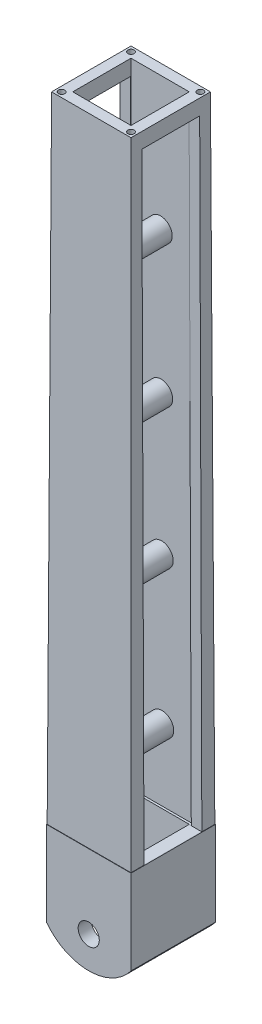
from build123d import *

# Parameters (mm, degrees)
SKETCH1_W               = 80
SKETCH1_H               = 80
BOSS_EXTRUDE1_DEPTH     = 700
BOSS_EXTRUDE1_TAPER     = 0.2
SHELL2_T                = -10
SKETCH2_R               = 3
CUT_EXTRUDE1_DEPTH      = 10
CUT_EXTRUDE2_DEPTH      = 704.704483544
CUT_EXTRUDE2_DEPTH_BACK = 704.704483544
SKETCH4_W               = 55.112936398
SKETCH4_H               = 55.112936398
SKETCH8_W               = 80
SKETCH8_H               = 80
SKETCH8_W_2             = 55.112936398
SKETCH8_H_2             = 55.112936398
BOSS_EXTRUDE3_DEPTH     = 100
CUT_EXTRUDE4_DEPTH      = 706.691150691
CUT_EXTRUDE4_DEPTH_BACK = 706.691150691
SKETCH9_R               = 10
CUT_EXTRUDE5_DEPTH      = 706.691150691
CUT_EXTRUDE5_DEPTH_BACK = 706.691150691
CUT_EXTRUDE6_DEPTH      = 707.968504527
CUT_EXTRUDE6_DEPTH_BACK = 707.968504527
SKETCH13_W              = 54.721685152
SKETCH13_H              = 585.463174199
SKETCH14_R              = 11
BOSS_EXTRUDE4_DEPTH     = 68


with BuildPart() as part:
    # Sketch1 → Boss-Extrude1 (new body)
    with BuildSketch(Plane(origin=(0, 0, 0), x_dir=(1, 0, 0), z_dir=(0, 1, 0))):
        with Locations((0, 20)):
            Rectangle(SKETCH1_W, SKETCH1_H)
    extrude(amount=BOSS_EXTRUDE1_DEPTH, taper=BOSS_EXTRUDE1_TAPER)

    # Shell2
    shell2_openings = [part.faces().sort_by_distance(p)[0] for p in [
        (0, 700, -20),
    ]]
    offset(amount=SHELL2_T, openings=shell2_openings, kind=Kind.INTERSECTION)

    # Sketch2 → Cut-Extrude1 (cut)
    with BuildSketch(Plane(origin=(0, 700, 0), x_dir=(1, 0, 0), z_dir=(0, 1, 0))):
        with Locations((-32.80796506, 52.80796506)):
            Circle(SKETCH2_R)
        with Locations((32.80796506, 52.80796506)):
            Circle(SKETCH2_R)
        with Locations((32.80796506, -12.80796506)):
            Circle(SKETCH2_R)
        with Locations((-32.80796506, -12.80796506)):
            Circle(SKETCH2_R)
    extrude(amount=-CUT_EXTRUDE1_DEPTH, mode=Mode.SUBTRACT)

    # Sketch4 → Cut-Extrude2 (cut, two sides: drawn at the far end of the back side and taken through both)
    with BuildSketch(Plane(origin=(0, 700, 0), x_dir=(1, 0, 0), z_dir=(0, 1, 0)).offset(-CUT_EXTRUDE2_DEPTH_BACK)):
        with Locations((0, 20)):
            Rectangle(SKETCH4_W, SKETCH4_H)
    extrude(amount=CUT_EXTRUDE2_DEPTH + CUT_EXTRUDE2_DEPTH_BACK, mode=Mode.SUBTRACT)

    # Sketch8 → Boss-Extrude3 (add)
    with BuildSketch(Plane.XZ):
        with Locations((0, -20)):
            Rectangle(SKETCH8_W, SKETCH8_H)
        with Locations((0, -20)):
            Rectangle(SKETCH8_W_2, SKETCH8_H_2, mode=Mode.SUBTRACT)
    extrude(amount=-BOSS_EXTRUDE3_DEPTH)

    # Sketch9 → Cut-Extrude4 (cut, two sides: drawn at the far end of the back side and taken through both)
    with BuildSketch(Plane.XY.offset(20).offset(-CUT_EXTRUDE4_DEPTH_BACK)):
        with Locations((0, 30)):
            Circle(SKETCH9_R)
    extrude(amount=CUT_EXTRUDE4_DEPTH + CUT_EXTRUDE4_DEPTH_BACK, mode=Mode.SUBTRACT)

    # Sketch10 → Cut-Extrude5 (cut, two sides: drawn at the far end of the back side and taken through both)
    with BuildSketch(Plane.XY.offset(20).offset(-CUT_EXTRUDE5_DEPTH_BACK)):
        with BuildLine():
            Line((-1.42e-07, 0), (40, 0))
            Line((40, 0), (40, 19.876189785))
            ThreePointArc((40, 19.876189785), (22.333063544, 5.242902004), (-1.42e-07, 0))
        make_face()
        with BuildLine():
            Line((-40, 0), (-1.42e-07, 0))
            ThreePointArc((-1.42e-07, 0), (-22.333063671, 5.242902067), (-40, 19.876189785))
            Line((-40, 19.876189785), (-40, 0))
        make_face()
    extrude(amount=CUT_EXTRUDE5_DEPTH + CUT_EXTRUDE5_DEPTH_BACK, mode=Mode.SUBTRACT)

    # Sketch13 → Cut-Extrude6 (cut, two sides: drawn at the far end of the back side and taken through both)
    with BuildSketch(Plane(origin=(39.999512614, 0.139625206, 0), x_dir=(0, 0, -1), z_dir=(0.9999939076577905, 0.0034906514152237404, 0)).offset(-CUT_EXTRUDE6_DEPTH_BACK)):
        with Locations((20, 392.592570281)):
            Rectangle(SKETCH13_W, SKETCH13_H)
    extrude(amount=CUT_EXTRUDE6_DEPTH + CUT_EXTRUDE6_DEPTH_BACK, mode=Mode.SUBTRACT)

    # Sketch14 → Boss-Extrude4 (add)
    with BuildSketch(Plane(origin=(0, 0.209437809, -59.999268921), x_dir=(-1, 0, 0), z_dir=(0, 0.0034906514152237404, -0.9999939076577905))):
        with Locations((0, 167.378380539)):
            Circle(SKETCH14_R)
        with Locations((0, 306.630729062)):
            Circle(SKETCH14_R)
        with Locations((0, 439.3151205)):
            Circle(SKETCH14_R)
        with Locations((0, 573.229273125)):
            Circle(SKETCH14_R)
    extrude(amount=-BOSS_EXTRUDE4_DEPTH)


solid = part.part
